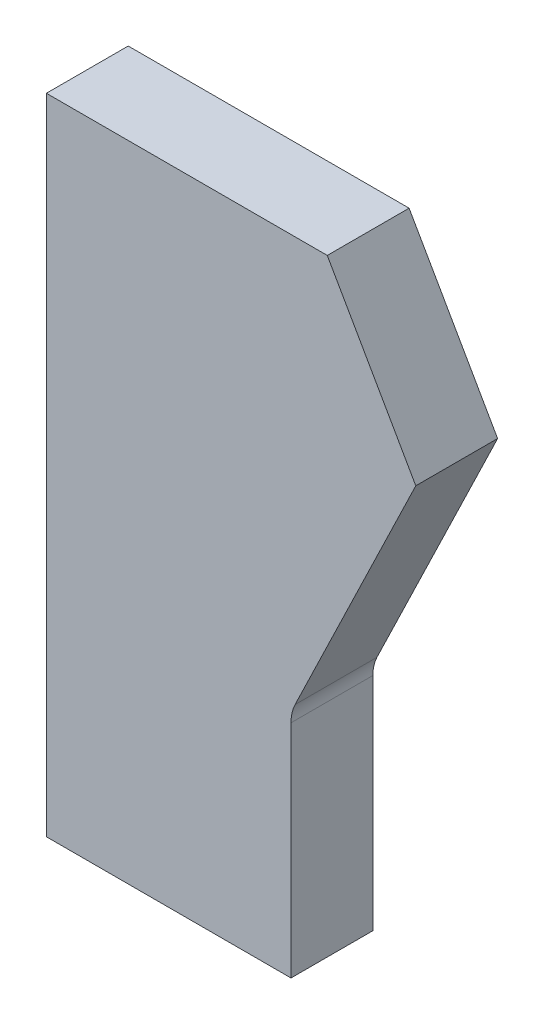
from build123d import *

# Parameters (mm, degrees)
EXTRUDE1_DEPTH = 25.4


with BuildPart() as part:
    # Sketch2 → Extrude1 (new body)
    with BuildSketch(Plane.XY):
        with BuildLine():
            Line((0, 0), (75.929788313, 0))
            Line((75.929788313, 0), (75.929788313, 68.608572188))
            ThreePointArc((75.929788313, 68.608572188), (76.25000769, 71.442479692), (77.194517721, 74.133478204))
            Line((77.194517721, 74.133478204), (114.663486186, 151.685529213))
            Line((114.663486186, 151.685529213), (87.189584206, 199.877455637))
            Line((87.189584206, 199.877455637), (0, 199.877455637))
            Line((0, 199.877455637), (0, 0))
        make_face()
    extrude(amount=-EXTRUDE1_DEPTH)


solid = part.part
